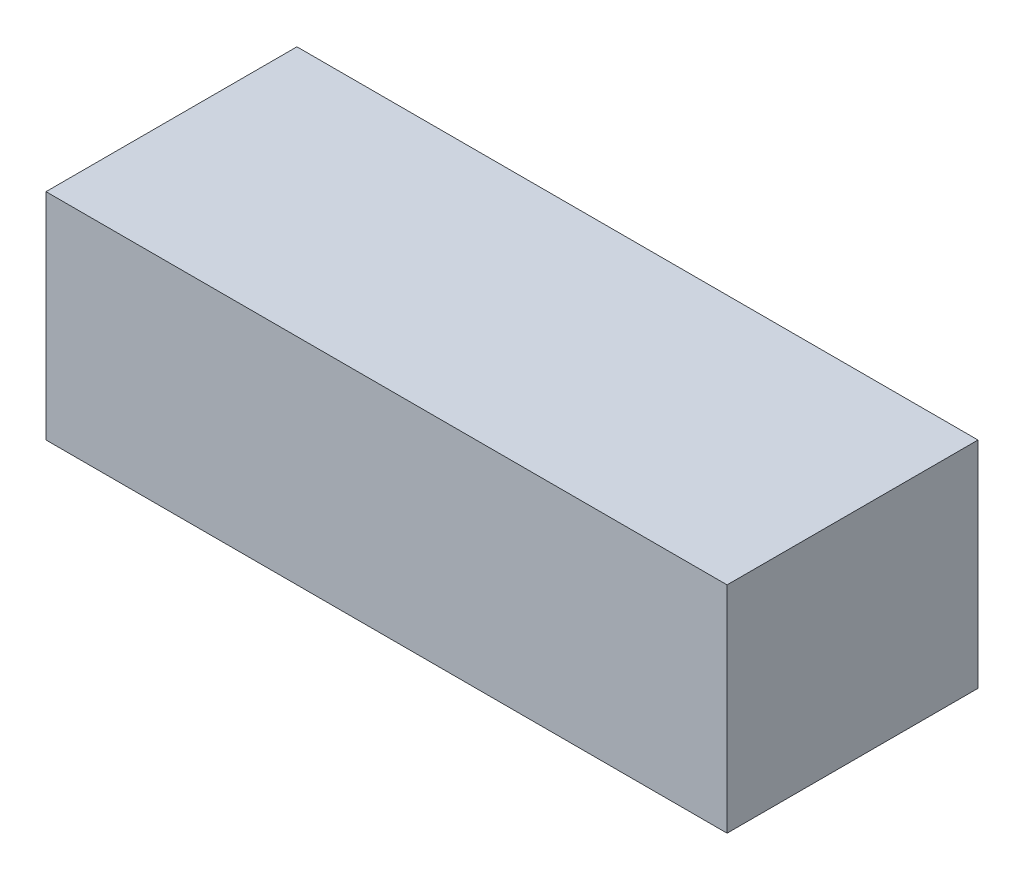
from build123d import *

# Parameters (mm, degrees)
SKETCH1_W           = 152
SKETCH1_H           = 56
BOSS_EXTRUDE1_DEPTH = 48


with BuildPart() as part:
    # Sketch1 → Boss-Extrude1 (new body)
    with BuildSketch(Plane(origin=(0, 0, 0), x_dir=(1, 0, 0), z_dir=(0, 1, 0))):
        with Locations((76, 28)):
            Rectangle(SKETCH1_W, SKETCH1_H)
    extrude(amount=BOSS_EXTRUDE1_DEPTH)


solid = part.part
